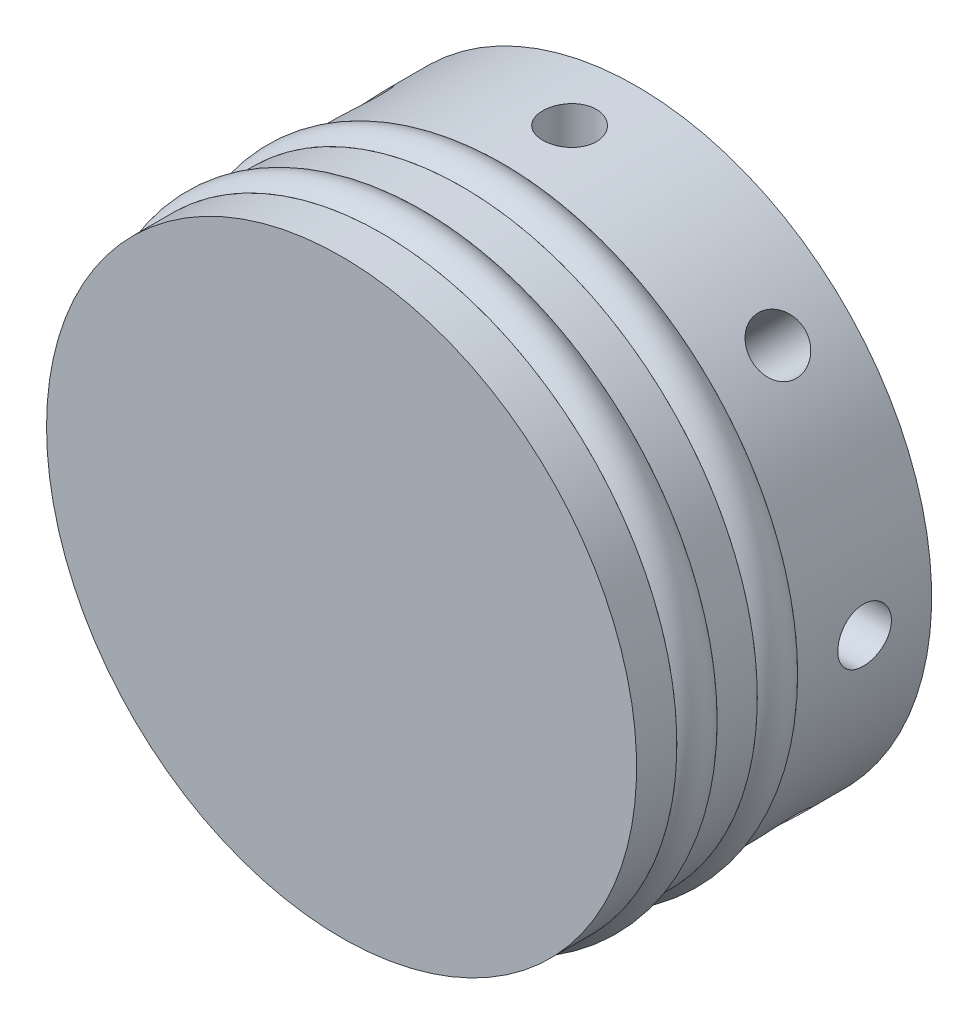
from build123d import *

# Parameters (mm, degrees)
ESBO_O3_R             = 2
CORTE_EXTRUS_O1_DEPTH = 8
PADR_OCIRCULAR1_COUNT = 8


with BuildPart() as part:
    # Esboço2 → Revolução1 (revolve)
    with BuildSketch(Plane(origin=(0, 0, 0), x_dir=(1, 0, 0), z_dir=(0, 1, 0))):
        Polygon((-14.5, 15.345597198), (-22, 15.345597198), (-22, 5.345597198), (-20, 5.345597198), (-20, 2.345597198), (-22, 2.345597198), (-22, -0.654402802), (-20, -0.654402802), (-20, -3.654402802), (-22, -3.654402802), (-22, -6.654402802), (0, -6.654402802), (0, -0.654402802), (0, 7.541792329), (-14.5, 7.541792329), align=None)
    revolve(axis=Axis((0, 0, -1026.34324457), (0, 0, 1)))

    # Esboço3 → Corte-extrusão1 (cut)
    with BuildSketch(Plane(origin=(0, 22, 0), x_dir=(1, 0, 0), z_dir=(0, 1, 0))):
        with Locations((0, 10.345597198)):
            Circle(ESBO_O3_R)
    corte_extrus_o1 = extrude(amount=-CORTE_EXTRUS_O1_DEPTH, mode=Mode.SUBTRACT)

    # PadrãoCircular1: Corte-extrusão1 ×8 about axis
    padr_ocircular1_axis = Axis((0, 0, -15.345597198), (0, 0, -1))
    for i in range(1, PADR_OCIRCULAR1_COUNT):
        add(corte_extrus_o1.rotate(padr_ocircular1_axis, i * 360 / PADR_OCIRCULAR1_COUNT), mode=Mode.SUBTRACT)


with BuildPart() as body_2:
    # Esboço6 → Revolução3 (revolve)
    with BuildSketch(Plane(origin=(0, 0, 0), x_dir=(1, 0, 0), z_dir=(0, 1, 0))):
        with BuildLine():
            Line((22, 5.345597198), (20, 5.345597198))
            Line((20, 5.345597198), (20, 2.345597198))
            Line((20, 2.345597198), (22, 2.345597198))
            ThreePointArc((22, 2.345597198), (22.614393694, 3.845597198), (22, 5.345597198))
        make_face()
        with BuildLine():
            Line((20, -3.654402802), (20, -0.654402802))
            Line((20, -0.654402802), (22, -0.654402802))
            ThreePointArc((22, -0.654402802), (22.614393694, -2.154402802), (22, -3.654402802))
            Line((22, -3.654402802), (20, -3.654402802))
        make_face()
    revolve(axis=Axis((0, 0, 0), (0, 0, -1)))


solid = Compound([part.part, body_2.part])
